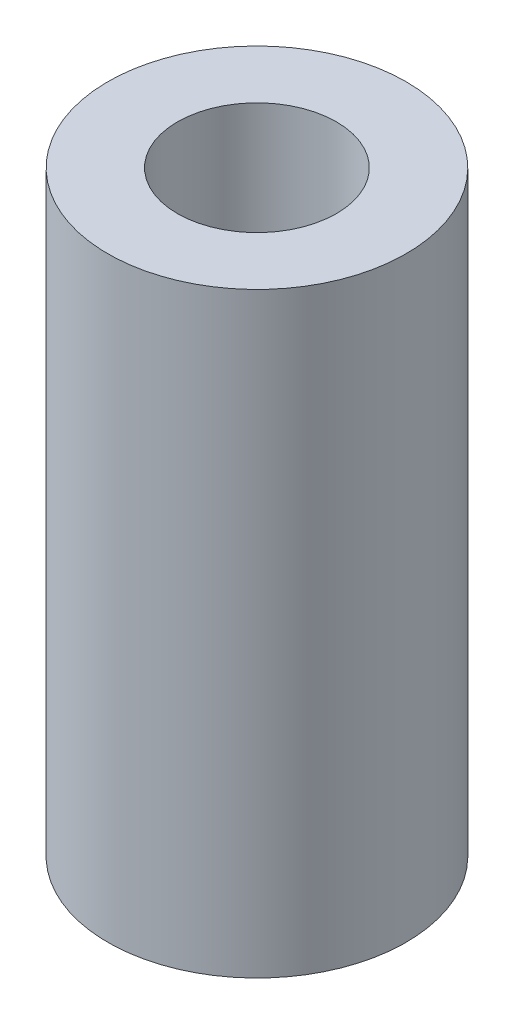
from build123d import *

# Parameters (mm, degrees)
CROQUIS1_R              = 3
CROQUIS1_R_2            = 1.6
SALIENTE_EXTRUIR1_DEPTH = 12


with BuildPart() as part:
    # Croquis1 → Saliente-Extruir1 (new body)
    with BuildSketch(Plane.XZ):
        with Locations(Location((0, 0, 0), (0, 0, 270))):
            Circle(CROQUIS1_R)
        with Locations(Location((0, 0, 0), (0, 0, 270))):
            Circle(CROQUIS1_R_2, mode=Mode.SUBTRACT)
    extrude(amount=-SALIENTE_EXTRUIR1_DEPTH)


solid = part.part
